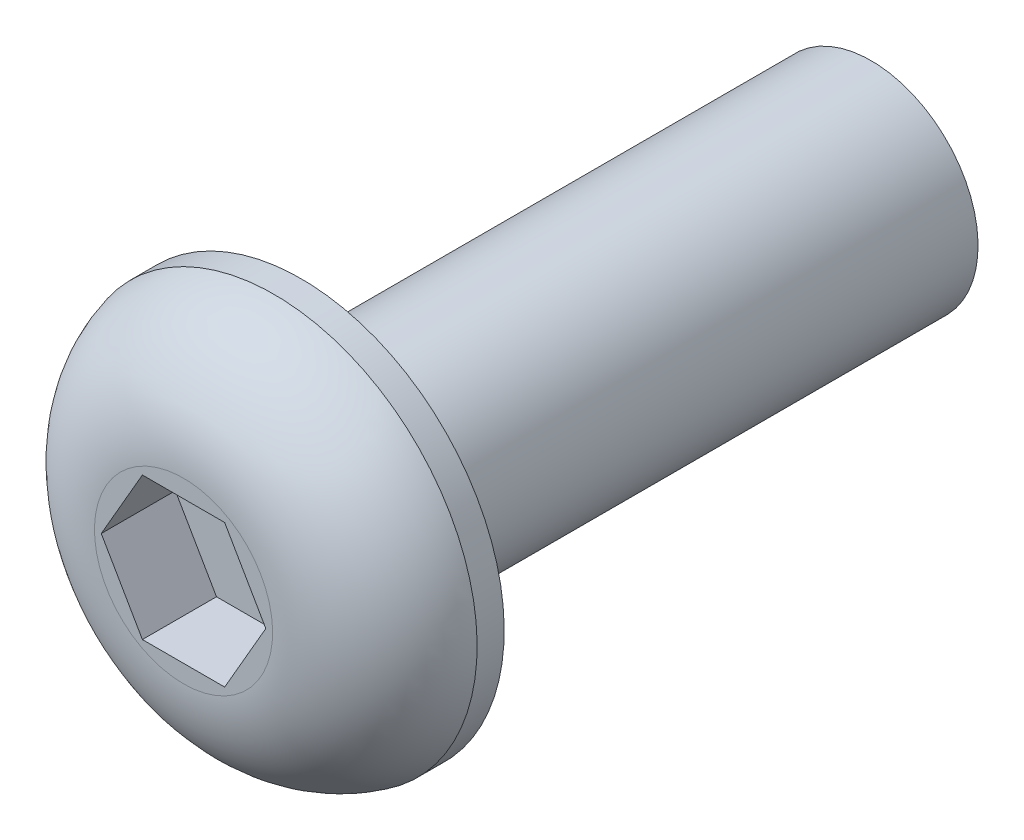
from build123d import *

# Parameters (mm, degrees)
CUT_EXTRUDE1_DEPTH = 1.04


with BuildPart() as part:
    # Sketch1 → Revolve1 (revolve)
    with BuildSketch(Plane(origin=(0, 0, 0), x_dir=(0, 0, -1), z_dir=(1, 0, 0))):
        with BuildLine():
            Line((-1.65, 0), (-1.65, 1.25))
            ThreePointArc((-1.65, 1.25), (-1.293908806, 2.271383865), (-0.38, 2.85))
            Line((-0.38, 2.85), (0, 2.85))
            Line((0, 2.85), (0, 1.5))
            Line((0, 1.5), (8, 1.5))
            Line((8, 1.5), (8, 0))
            Line((8, 0), (-1.65, 0))
        make_face()
    revolve(axis=Axis((0, 0, 5.584882278), (0, 0, -1)))

    # Sketch2 → Cut-Extrude1 (cut)
    with BuildSketch(Plane.XY.offset(1.65)):
        Polygon((0.577350269, -1), (1.154700538, 0), (0.577350269, 1), (-0.577350269, 1), (-1.154700538, 0), (-0.577350269, -1), align=None)
    extrude(amount=-CUT_EXTRUDE1_DEPTH, mode=Mode.SUBTRACT)


solid = part.part
